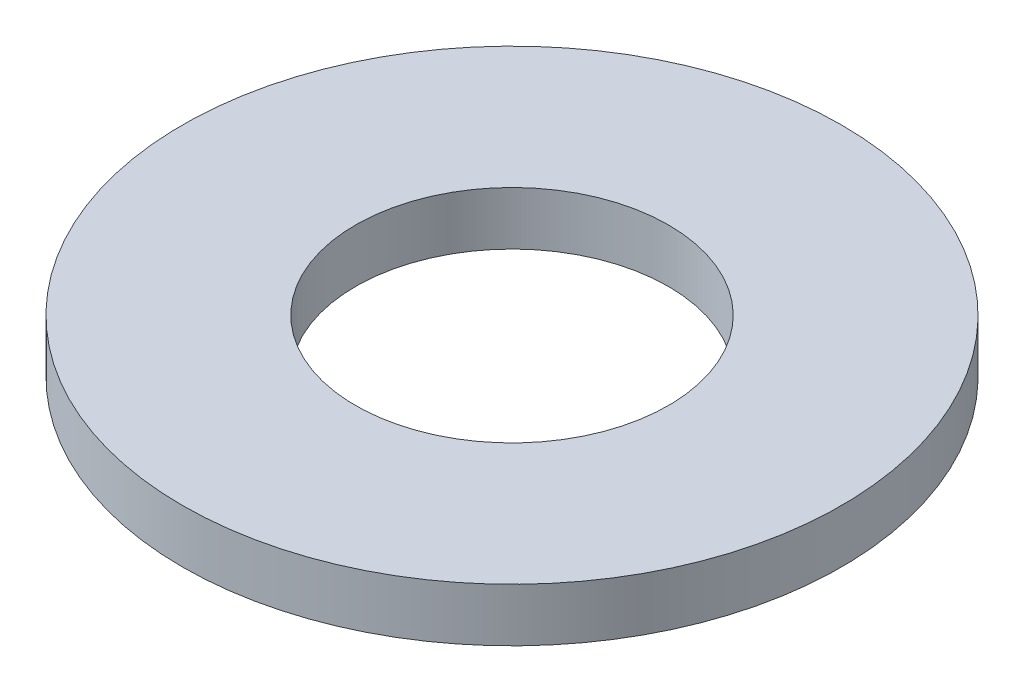
from build123d import *

# Parameters (mm, degrees)
SKETCH1_R           = 12.36
BOSS_EXTRUDE1_DEPTH = 2
SKETCH2_R           = 5.8674
CUT_EXTRUDE1_DEPTH  = 18.593726155


with BuildPart() as part:
    # Sketch1 → Boss-Extrude1 (new body)
    with BuildSketch(Plane(origin=(0, 0, 0), x_dir=(1, 0, 0), z_dir=(0, 1, 0))):
        with Locations(Location((0, 0, 0), (0, 0, 270))):
            Circle(SKETCH1_R)
    extrude(amount=BOSS_EXTRUDE1_DEPTH)

    # Sketch2 → Cut-Extrude1 (cut, through all)
    with BuildSketch(Plane(origin=(0, 0, 0), x_dir=(-1, 0, 0), z_dir=(0, -1, 0))):
        with Locations(Location((0, 0, 0), (0, 0, 90))):
            Circle(SKETCH2_R)
    extrude(amount=-CUT_EXTRUDE1_DEPTH, mode=Mode.SUBTRACT)


solid = part.part
